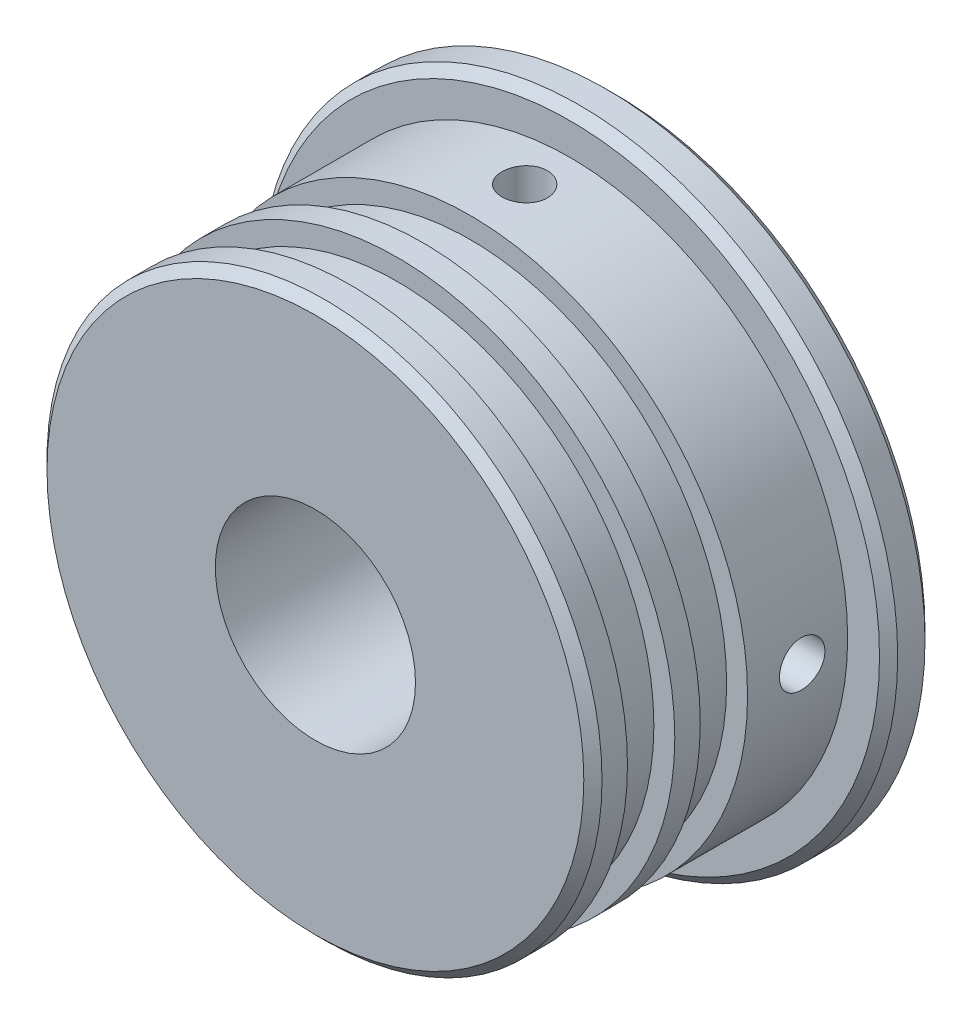
from build123d import *

# Parameters (mm, degrees)
SKETCH_1_R               = 17.5
SKETCH_1_R_2             = 5.5
EXTRUDE_1_DEPTH          = 2.5
EXTRUDE_START            = 14
SKETCH_1_3_R             = 15.25
SKETCH_1_3_R_2           = 5.5
EXTRUDE_2_DEPTH          = 14
CUT_EXTRUDE_START        = 8.1
SKETCH_1_4_R             = 15.25
SKETCH_1_4_R_2           = 14.1
CUT_EXTRUDE_1_DEPTH      = 2.6
CUT_EXTRUDE_START_2      = 12.1
SKETCH_1_5_R             = 15.25
SKETCH_1_5_R_2           = 14.1
CUT_EXTRUDE_2_DEPTH      = 2.6
CHAMFER_1_SIZE           = 0.5
SKETCH_2_R               = 6
CUT_EXTRUDE_3_DEPTH      = 2.5
CUT_EXTRUDE_START_3      = 10
SKETCH_3_R               = 1.25
CUT_EXTRUDE_4_DEPTH      = 10
PATTERN_CIRCULAR_1_COUNT = 4


with BuildPart() as part:
    # Эскиз1 → Бобышка-Вытянуть1 (new body)
    with BuildSketch(Plane.XY):
        Circle(SKETCH_1_R)
        Circle(SKETCH_1_R_2, mode=Mode.SUBTRACT)
    extrude(amount=-EXTRUDE_1_DEPTH)

    # Эскиз1<3> → Бобышка-Вытянуть2 (add)
    with BuildSketch(Plane.XY.offset(EXTRUDE_START)):
        Circle(SKETCH_1_3_R)
        Circle(SKETCH_1_3_R_2, mode=Mode.SUBTRACT)
    extrude(amount=-EXTRUDE_2_DEPTH)

    # Эскиз1<4> → Вырез-Вытянуть1 (cut)
    with BuildSketch(Plane.XY.offset(CUT_EXTRUDE_START)):
        Circle(SKETCH_1_4_R)
        Circle(SKETCH_1_4_R_2, mode=Mode.SUBTRACT)
    extrude(amount=-CUT_EXTRUDE_1_DEPTH, mode=Mode.SUBTRACT)

    # Эскиз1<5> → Вырез-Вытянуть2 (cut)
    with BuildSketch(Plane.XY.offset(CUT_EXTRUDE_START_2)):
        Circle(SKETCH_1_5_R)
        Circle(SKETCH_1_5_R_2, mode=Mode.SUBTRACT)
    extrude(amount=-CUT_EXTRUDE_2_DEPTH, mode=Mode.SUBTRACT)

    # Фаска1
    chamfer_1_edges = [part.edges().sort_by_distance(p)[0] for p in [
        (-15.25, 0, 14),
        (-17.5, 0, 0),
        (-17.5, 0, -2.5),
    ]]
    chamfer(chamfer_1_edges, length=CHAMFER_1_SIZE)

    # Эскиз2 → Вырез-Вытянуть3 (cut)
    with BuildSketch(Plane(origin=(0, 0, -2.5), x_dir=(-1, 0, 0), z_dir=(0, 0, -1))):
        Circle(SKETCH_2_R)
    extrude(amount=-CUT_EXTRUDE_3_DEPTH, mode=Mode.SUBTRACT)

    # Эскиз3 → Вырез-Вытянуть4 (cut)
    with BuildSketch(Plane(origin=(0, 0, 0), x_dir=(1, 0, 0), z_dir=(0, 1, 0)).offset(CUT_EXTRUDE_START_3)):
        with Locations((0, -2.5)):
            Circle(SKETCH_3_R)
    cut_extrude_4 = extrude(amount=CUT_EXTRUDE_4_DEPTH, mode=Mode.SUBTRACT)

    # Круговой массив1: Вырез-Вытянуть4 ×4 about axis
    pattern_circular_1_axis = Axis((0, 0, 0), (0, 0, -1))
    for i in range(1, PATTERN_CIRCULAR_1_COUNT):
        add(cut_extrude_4.rotate(pattern_circular_1_axis, i * 360 / PATTERN_CIRCULAR_1_COUNT), mode=Mode.SUBTRACT)


solid = part.part
